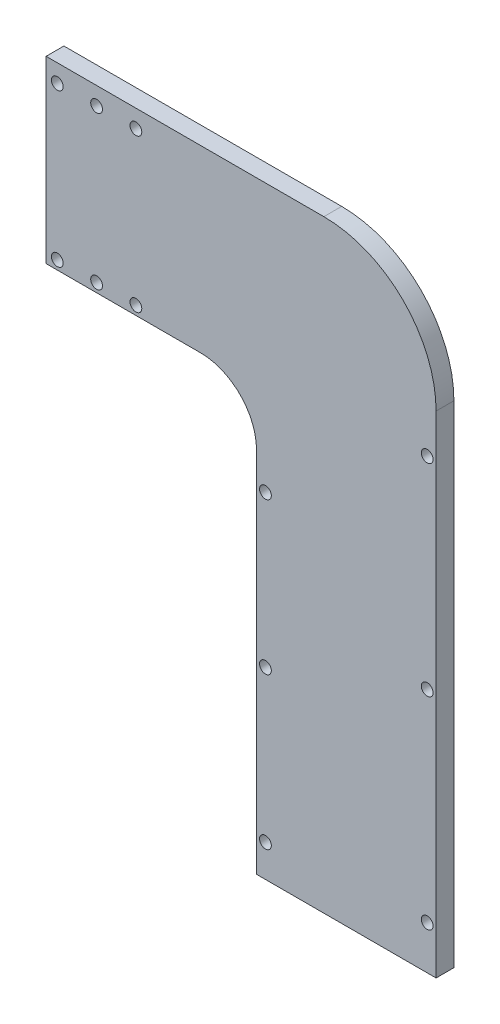
from build123d import *

# Parameters (mm, degrees)
BOSS_EXTRUDE1_DEPTH = 3.175
FILLET2_R           = 40
FILLET3_R           = 20
SKETCH2_R           = 2.1
CUT_EXTRUDE1_DEPTH  = 129.167166232
SKETCH3_R           = 2.1
CUT_EXTRUDE2_DEPTH  = 129.167166232
SKETCH4_R           = 2.1
CUT_EXTRUDE3_DEPTH  = 129.167166232


with BuildPart() as part:
    # Sketch1 → Boss-Extrude1 (new, symmetric)
    with BuildSketch(Plane.XY):
        Polygon((-69.5, 107.5), (-69.5, 43.5), (5.5, 43.5), (5.5, -107.5), (69.5, -107.5), (69.5, 107.5), align=None)
    extrude(amount=BOSS_EXTRUDE1_DEPTH, both=True)

    # Fillet2
    fillet2_edges = [part.edges().sort_by_distance(p)[0] for p in [
        (69.5, 107.5, 0),
    ]]
    fillet(fillet2_edges, radius=FILLET2_R)

    # Fillet3
    fillet3_edges = [part.edges().sort_by_distance(p)[0] for p in [
        (5.5, 43.5, 0),
    ]]
    fillet(fillet3_edges, radius=FILLET3_R)

    # Sketch2 → Cut-Extrude1 (cut, through all)
    with BuildSketch(Plane.XY.offset(3.175)):
        with Locations((-37.5, 101.15)):
            Circle(SKETCH2_R)
        with Locations((-51.5, 101.15)):
            Circle(SKETCH2_R)
        with Locations((-65.5, 101.15)):
            Circle(SKETCH2_R)
        with Locations((-65.5, 46.675)):
            Circle(SKETCH2_R)
        with Locations((-37.5, 46.675)):
            Circle(SKETCH2_R)
        with Locations((-51.5, 46.675)):
            Circle(SKETCH2_R)
    extrude(amount=-CUT_EXTRUDE1_DEPTH, mode=Mode.SUBTRACT)

    # Sketch3 → Cut-Extrude2 (cut, through all)
    with BuildSketch(Plane.XY.offset(3.175)):
        with Locations((66.325, -92)):
            Circle(SKETCH3_R)
        with Locations((66.325, 52)):
            Circle(SKETCH3_R)
        with Locations((66.325, -20)):
            Circle(SKETCH3_R)
    extrude(amount=-CUT_EXTRUDE2_DEPTH, mode=Mode.SUBTRACT)

    # Sketch4 → Cut-Extrude3 (cut, through all)
    with BuildSketch(Plane.XY.offset(3.175)):
        with Locations((8.675, -96)):
            Circle(SKETCH4_R)
        with Locations((8.675, -42)):
            Circle(SKETCH4_R)
        with Locations((8.675, 12)):
            Circle(SKETCH4_R)
    extrude(amount=-CUT_EXTRUDE3_DEPTH, mode=Mode.SUBTRACT)


solid = part.part
